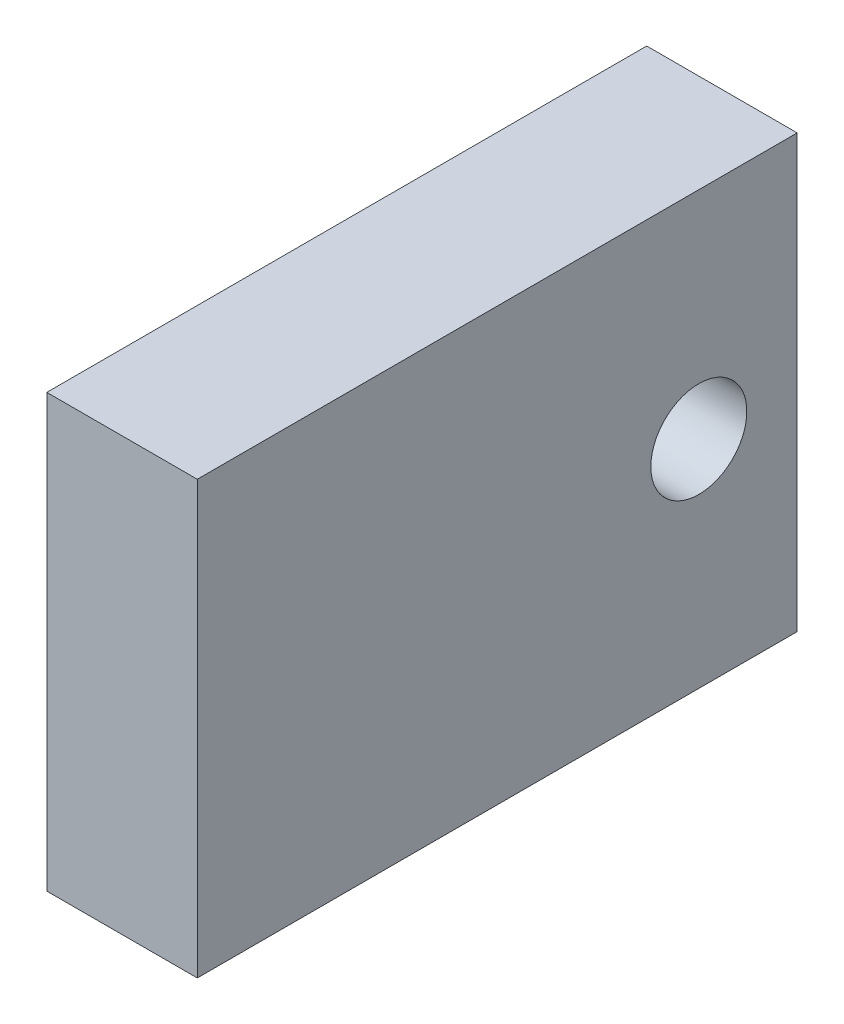
from build123d import *

# Parameters (mm, degrees)
SKETCH1_W           = 15.928987192
SKETCH1_H           = 63.5
BOSS_EXTRUDE1_DEPTH = 45.72
SKETCH2_R           = 5.08
CUT_EXTRUDE1_DEPTH  = 50.8


with BuildPart() as part:
    # Sketch1 → Boss-Extrude1 (new body)
    with BuildSketch(Plane(origin=(0, 0, 0), x_dir=(1, 0, 0), z_dir=(0, 1, 0))):
        Rectangle(SKETCH1_W, SKETCH1_H)
    extrude(amount=BOSS_EXTRUDE1_DEPTH)

    # Sketch2 → Cut-Extrude1 (cut)
    with BuildSketch(Plane.ZY.offset(7.964493596)):
        with Locations((-21.336, 22.86)):
            Circle(SKETCH2_R)
    extrude(amount=-CUT_EXTRUDE1_DEPTH, mode=Mode.SUBTRACT)


solid = part.part
